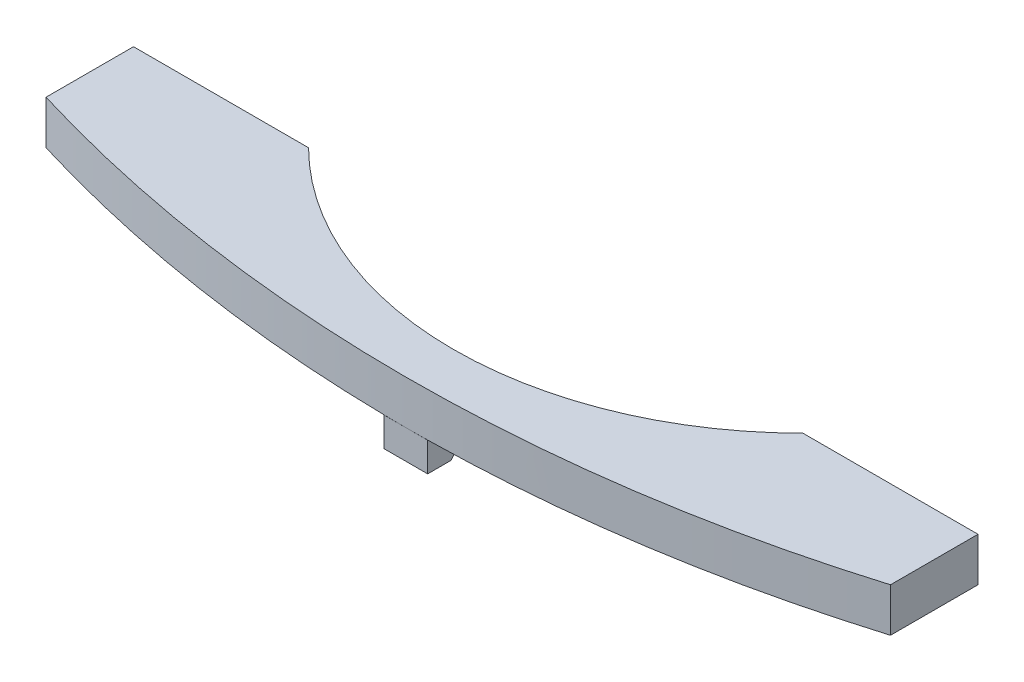
from build123d import *

# Parameters (mm, degrees)
BOSS_EXTRUDE1_DEPTH = 9.525
BOSS_EXTRUDE2_DEPTH = 4.7625


with BuildPart() as part:
    # Sketch1 → Boss-Extrude1 (new body)
    with BuildSketch(Plane(origin=(0, 0, 0), x_dir=(1, 0, 0), z_dir=(0, 1, 0))):
        with BuildLine():
            Line((0, 0), (0, -19.05))
            ThreePointArc((0, -19.05), (91.91625, -32.645980635), (183.8325, -19.05))
            Line((183.8325, -19.05), (183.8325, 0))
            Line((183.8325, 0), (145.7325, 0))
            ThreePointArc((145.7325, 0), (91.91625, -22.253255558), (38.1, 0))
            Line((38.1, 0), (0, 0))
        make_face()
    extrude(amount=BOSS_EXTRUDE1_DEPTH)

    # Sketch2 → Boss-Extrude2 (add, symmetric)
    with BuildSketch(Plane(origin=(91.91625, 0, 0), x_dir=(0, 0, -1), z_dir=(1, 0, 0))):
        Polygon((-32.645980635, 0), (-32.645980635, -6.35), (-27.581538216, -6.35), (-22.253255558, 0), align=None)
    extrude(amount=BOSS_EXTRUDE2_DEPTH, both=True)


solid = part.part
